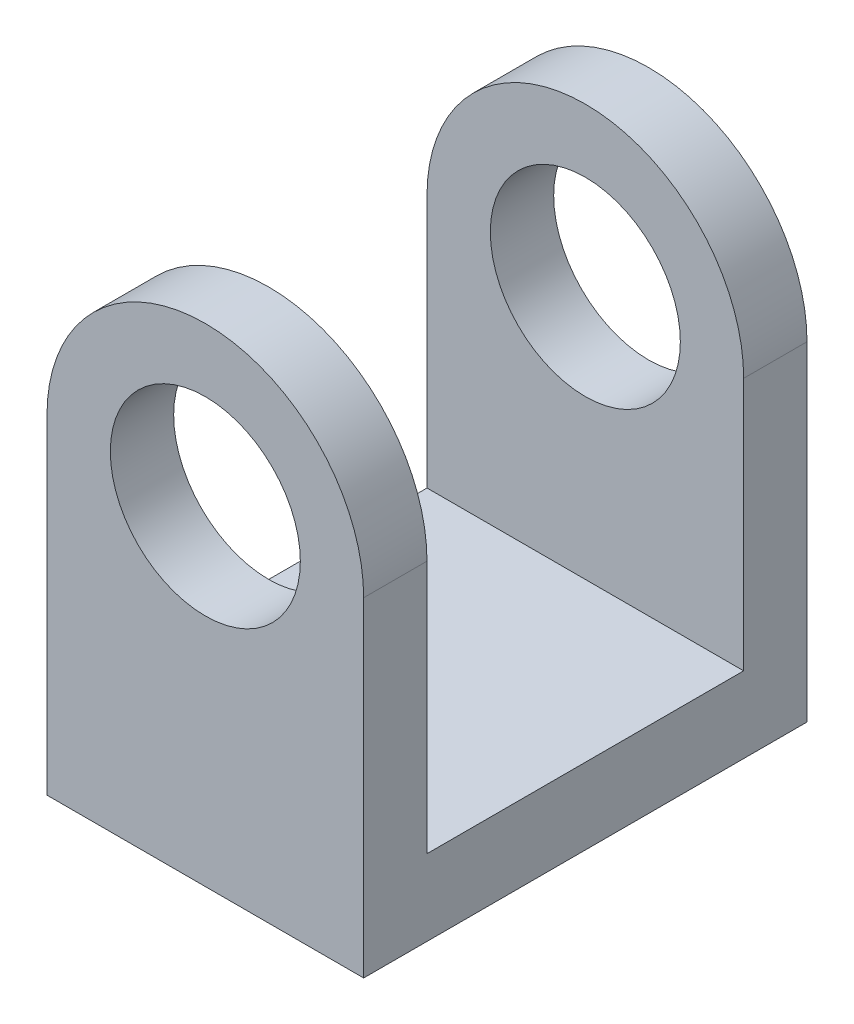
from build123d import *

# Parameters (mm, degrees)
SKETCH2_R           = 15
BOSS_EXTRUDE2_DEPTH = 5
SKETCH3_W           = 50
SKETCH3_H           = 5
BOSS_EXTRUDE3_DEPTH = 60
SKETCH4_R           = 10
BOSS_EXTRUDE4_DEPTH = 15
SKETCH5_W           = 50
SKETCH5_H           = 70
SKETCH5_R           = 15
BOSS_EXTRUDE5_DEPTH = 7


with BuildPart() as part:
    # Sketch2 → Boss-Extrude2 (new, symmetric)
    with BuildSketch(Plane.XY.offset(30)):
        with BuildLine():
            Line((-25, 22.5), (-25, -22.5))
            Line((-25, -22.5), (25, -22.5))
            Line((25, -22.5), (25, 22.5))
            ThreePointArc((25, 22.5), (0, 47.5), (-25, 22.5))
        make_face()
        with Locations((0, 22.5)):
            Circle(SKETCH2_R, mode=Mode.SUBTRACT)
    boss_extrude2 = extrude(amount=BOSS_EXTRUDE2_DEPTH, both=True)

    # Sketch3 → Boss-Extrude3 (add)
    with BuildSketch(Plane(origin=(0, 0, 25), x_dir=(-1, 0, 0), z_dir=(0, 0, -1))):
        with Locations((0, -20)):
            Rectangle(SKETCH3_W, SKETCH3_H)
    extrude(amount=BOSS_EXTRUDE3_DEPTH)

    # Mirror3: Boss-Extrude2 across plane
    add(boss_extrude2.mirror(Plane.XY))

    # Sketch4 → Boss-Extrude4 (add)
    with BuildSketch(Plane.XZ.offset(22.5)):
        with Locations(Location((0, 0, 0), (0, 0, 270))):
            Circle(SKETCH4_R)
    extrude(amount=BOSS_EXTRUDE4_DEPTH)

    # Sketch5 → Boss-Extrude5 (add)
    with BuildSketch(Plane.XZ.offset(22.5)):
        Rectangle(SKETCH5_W, SKETCH5_H)
        with Locations(Location((0, 0, 0), (0, 0, 270))):
            Circle(SKETCH5_R, mode=Mode.SUBTRACT)
    extrude(amount=BOSS_EXTRUDE5_DEPTH)


solid = part.part
